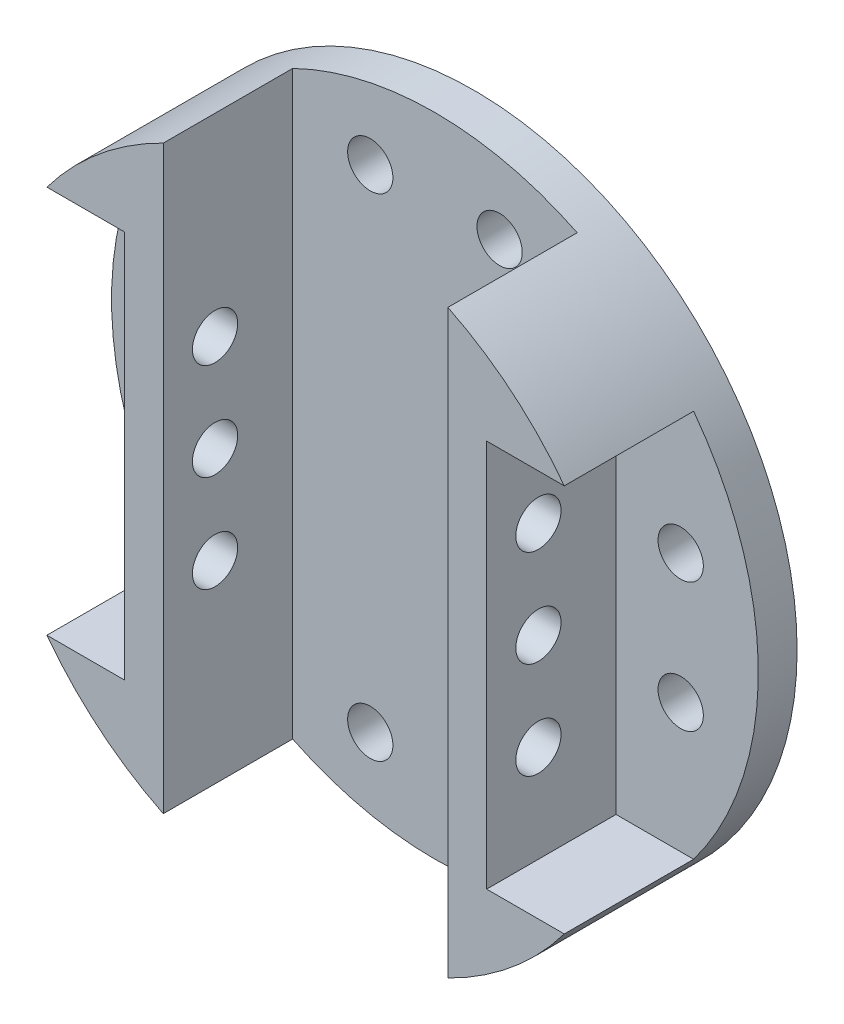
from build123d import *

# Parameters (mm, degrees)
SKETCH1_R                                  = 25
BOSS_EXTRUDE1_DEPTH                        = 13
SKETCH3_W                                  = 22
SKETCH3_H                                  = 50
SKETCH3_H_2                                = 30
CUT_EXTRUDE1_DEPTH                         = 10
CUT_EXTRUDE2_DEPTH                         = 38.669616404
CUT_EXTRUDE2_DEPTH_BACK                    = 38.669616404
SKETCH4_R                                  = 1.75
SKETCH5_R                                  = 1.75
CUT_EXTRUDE3_DEPTH                         = 37.742346142
MIRROR1_AT_THE_SECOND_PLANE_COPY_1_SKETC_R = 1.75
MIRROR1_AT_THE_SECOND_PLANE_COPY_1_DEPTH   = 37.742346142


with BuildPart() as part:
    # Sketch1 → Boss-Extrude1 (new body)
    with BuildSketch(Plane.XY):
        with Locations(Location((0, 0, 0), (0, 0, 180))):
            Circle(SKETCH1_R)
    extrude(amount=BOSS_EXTRUDE1_DEPTH)

    # Sketch3 → Cut-Extrude1 (cut)
    with BuildSketch(Plane.XY.offset(13)):
        Rectangle(SKETCH3_W, SKETCH3_H)
        with Locations((25, 0)):
            Rectangle(SKETCH3_W, SKETCH3_H_2)
        with Locations((-25, 0)):
            Rectangle(SKETCH3_W, SKETCH3_H_2)
    extrude(amount=-CUT_EXTRUDE1_DEPTH, mode=Mode.SUBTRACT)

    # Sketch4 → Cut-Extrude2 (cut, two sides: drawn at the far end of the back side and taken through both)
    with BuildSketch(Plane(origin=(0, 0, 0), x_dir=(0, 0, -1), z_dir=(1, 0, 0)).offset(-CUT_EXTRUDE2_DEPTH_BACK)):
        with Locations((-9, 7.5)):
            Circle(SKETCH4_R)
        with Locations((-9, 0)):
            Circle(SKETCH4_R)
        with Locations((-9, -7.5)):
            Circle(SKETCH4_R)
    extrude(amount=CUT_EXTRUDE2_DEPTH + CUT_EXTRUDE2_DEPTH_BACK, mode=Mode.SUBTRACT)

    # Sketch5 → Cut-Extrude3 (cut, through all)
    with BuildSketch(Plane.XY.offset(3)):
        with Locations((-19, 5)):
            Circle(SKETCH5_R)
        with Locations((-5, 19)):
            Circle(SKETCH5_R)
    cut_extrude3 = extrude(amount=-CUT_EXTRUDE3_DEPTH, mode=Mode.SUBTRACT)

    # Mirror1: Cut-Extrude3 across plane
    add(cut_extrude3.mirror(Plane(origin=(0, 0, 0), x_dir=(0, 0, 1), z_dir=(1, 0, 0))), mode=Mode.SUBTRACT)

    # Mirror1 at the second plane: Cut-Extrude3 across plane
    add(cut_extrude3.mirror(Plane.ZX), mode=Mode.SUBTRACT)

    # Mirror1 at the second plane copy 1 sketc → Mirror1 at the second plane copy 1 (cut, through all)
    with BuildSketch(Plane(origin=(0, 0, 3), x_dir=(-1, 0, 0), z_dir=(0, 0, 1))):
        with Locations((-19, 5)):
            Circle(MIRROR1_AT_THE_SECOND_PLANE_COPY_1_SKETC_R)
        with Locations((-5, 19)):
            Circle(MIRROR1_AT_THE_SECOND_PLANE_COPY_1_SKETC_R)
    extrude(amount=-MIRROR1_AT_THE_SECOND_PLANE_COPY_1_DEPTH, mode=Mode.SUBTRACT)


solid = part.part
